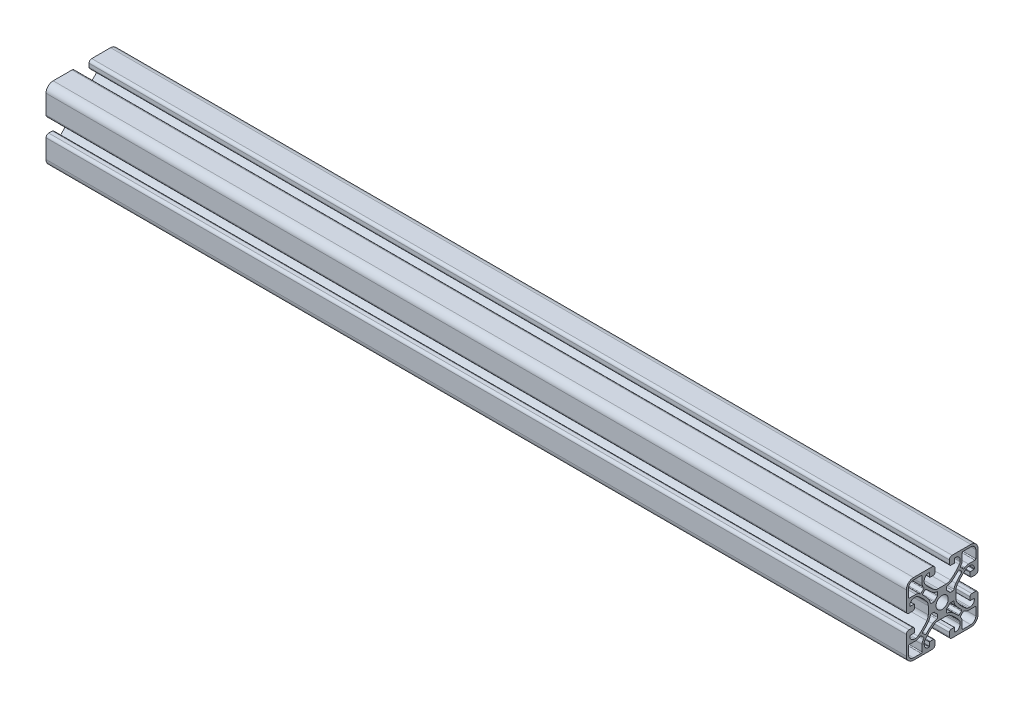
from build123d import *

# Parameters (mm, degrees)
SKETCH1_R           = 2.159
BOSS_EXTRUDE1_DEPTH = 304.8


with BuildPart() as part:
    # Sketch1 → Boss-Extrude1 (new body)
    with BuildSketch(Plane.YZ):
        with BuildLine():
            Line((0.772520695, -13.711151156), (0.772520695, -14.981151156))
            ThreePointArc((0.772520695, -14.981151156), (0.493539904, -15.654670365), (-0.179979305, -15.933651156))
            Line((-0.179979305, -15.933651156), (-6.847479304, -15.933651156))
            ThreePointArc((-6.847479304, -15.933651156), (-8.643530528, -15.18970238), (-9.387479304, -13.393651156))
            Line((-9.387479304, -13.393651156), (-9.387479304, -6.726151156))
            ThreePointArc((-9.387479304, -6.726151156), (-9.108498513, -6.052631947), (-8.434979304, -5.773651156))
            Line((-8.434979304, -5.773651156), (-7.164979304, -5.773651156))
            ThreePointArc((-7.164979304, -5.773651156), (-6.715966498, -5.95963835), (-6.529979304, -6.408651156))
            Line((-6.529979304, -6.408651156), (-6.529979304, -7.519901156))
            ThreePointArc((-6.529979304, -7.519901156), (-6.576476103, -7.632154358), (-6.688729304, -7.678651156))
            Line((-6.688729304, -7.678651156), (-7.958729304, -7.678651156))
            ThreePointArc((-7.958729304, -7.678651156), (-8.070982506, -7.725147955), (-8.117479304, -7.837401156))
            Line((-8.117479304, -7.837401156), (-8.117479304, -7.996151156))
            ThreePointArc((-8.117479304, -7.996151156), (-7.652511319, -9.118683171), (-6.529979304, -9.583651156))
            Line((-6.529979304, -9.583651156), (-6.034908058, -9.583651156))
            ThreePointArc((-6.034908058, -9.583651156), (-5.630688087, -9.517605564), (-5.268510552, -9.326338111))
            ThreePointArc((-5.268510552, -9.326338111), (-3.576591903, -7.846310071), (-2.110681684, -6.142144896))
            ThreePointArc((-2.110681684, -6.142144896), (-1.737480566, -5.424665046), (-1.608729304, -4.626241899))
            Line((-1.608729304, -4.626241899), (-1.608729304, -1.84106041))
            ThreePointArc((-1.608729304, -1.84106041), (-1.737480566, -1.042637264), (-2.110681683, -0.325157416))
            ThreePointArc((-2.110681683, -0.325157416), (-3.576591906, 1.379007761), (-5.268510559, 2.859035802))
            ThreePointArc((-5.268510559, 2.859035802), (-5.630688091, 3.050303253), (-6.034908058, 3.116348845))
            Line((-6.034908058, 3.116348845), (-6.529979305, 3.116348845))
            ThreePointArc((-6.529979305, 3.116348845), (-7.65251132, 2.65138086), (-8.117479305, 1.528848845))
            Line((-8.117479305, 1.528848845), (-8.117479305, 1.370098845))
            ThreePointArc((-8.117479305, 1.370098845), (-8.070982507, 1.257845643), (-7.958729305, 1.211348845))
            Line((-7.958729305, 1.211348845), (-6.688729305, 1.211348845))
            ThreePointArc((-6.688729305, 1.211348845), (-6.576476104, 1.164852046), (-6.529979305, 1.052598845))
            Line((-6.529979305, 1.052598845), (-6.529979305, -0.058651155))
            ThreePointArc((-6.529979305, -0.058651155), (-6.715966499, -0.507663961), (-7.164979305, -0.693651155))
            Line((-7.164979305, -0.693651155), (-8.434979305, -0.693651155))
            ThreePointArc((-8.434979305, -0.693651155), (-9.108498514, -0.414670364), (-9.387479305, 0.258848845))
            Line((-9.387479305, 0.258848845), (-9.387479305, 6.926348844))
            ThreePointArc((-9.387479305, 6.926348844), (-8.643530529, 8.722400069), (-6.847479305, 9.466348844))
            Line((-6.847479305, 9.466348844), (-0.179979306, 9.466348844))
            ThreePointArc((-0.179979306, 9.466348844), (0.493539903, 9.187368053), (0.772520694, 8.513848844))
            Line((0.772520694, 8.513848844), (0.772520694, 7.243848844))
            ThreePointArc((0.772520694, 7.243848844), (0.5865335, 6.794836038), (0.137520694, 6.608848844))
            Line((0.137520694, 6.608848844), (-0.973729306, 6.608848844))
            ThreePointArc((-0.973729306, 6.608848844), (-1.085982507, 6.655345643), (-1.132479306, 6.767598844))
            Line((-1.132479306, 6.767598844), (-1.132479306, 8.037598844))
            ThreePointArc((-1.132479306, 8.037598844), (-1.178976104, 8.149852046), (-1.291229306, 8.196348844))
            Line((-1.291229306, 8.196348844), (-1.449979306, 8.196348844))
            ThreePointArc((-1.449979306, 8.196348844), (-2.572511321, 7.73138086), (-3.037479306, 6.608848844))
            Line((-3.037479306, 6.608848844), (-3.037479306, 6.113777598))
            ThreePointArc((-3.037479306, 6.113777598), (-2.971433714, 5.709557627), (-2.780166261, 5.347380093))
            ThreePointArc((-2.780166261, 5.347380093), (-1.30013822, 3.655461444), (0.404026955, 2.189551224))
            ThreePointArc((0.404026955, 2.189551224), (1.121506805, 1.816350106), (1.919929952, 1.687598845))
            Line((1.919929952, 1.687598845), (4.705111441, 1.687598845))
            ThreePointArc((4.705111441, 1.687598845), (5.503534586, 1.816350106), (6.221014435, 2.189551223))
            ThreePointArc((6.221014435, 2.189551223), (7.925179612, 3.655461446), (9.405207653, 5.3473801))
            ThreePointArc((9.405207653, 5.3473801), (9.596475104, 5.709557631), (9.662520695, 6.113777598))
            Line((9.662520695, 6.113777598), (9.662520695, 6.608848846))
            ThreePointArc((9.662520695, 6.608848846), (9.197552711, 7.731380861), (8.075020695, 8.196348846))
            Line((8.075020695, 8.196348846), (7.916270695, 8.196348846))
            ThreePointArc((7.916270695, 8.196348846), (7.804017494, 8.149852047), (7.757520695, 8.037598846))
            Line((7.757520695, 8.037598846), (7.757520695, 6.767598846))
            ThreePointArc((7.757520695, 6.767598846), (7.711023897, 6.655345644), (7.598770695, 6.608848846))
            Line((7.598770695, 6.608848846), (6.487520696, 6.608848846))
            ThreePointArc((6.487520696, 6.608848846), (6.03850789, 6.79483604), (5.852520696, 7.243848846))
            Line((5.852520696, 7.243848846), (5.852520696, 8.513848846))
            ThreePointArc((5.852520696, 8.513848846), (6.131501487, 9.187368055), (6.805020696, 9.466348846))
            Line((6.805020696, 9.466348846), (13.472520695, 9.466348846))
            ThreePointArc((13.472520695, 9.466348846), (15.268571919, 8.72240007), (16.012520695, 6.926348846))
            Line((16.012520695, 6.926348846), (16.012520695, 0.258848846))
            ThreePointArc((16.012520695, 0.258848846), (15.733539904, -0.414670363), (15.060020695, -0.693651154))
            Line((15.060020695, -0.693651154), (13.790020695, -0.693651154))
            ThreePointArc((13.790020695, -0.693651154), (13.341007889, -0.50766396), (13.155020695, -0.058651154))
            Line((13.155020695, -0.058651154), (13.155020695, 1.052598846))
            ThreePointArc((13.155020695, 1.052598846), (13.201517494, 1.164852048), (13.313770695, 1.211348846))
            Line((13.313770695, 1.211348846), (14.583770695, 1.211348846))
            ThreePointArc((14.583770695, 1.211348846), (14.696023897, 1.257845645), (14.742520695, 1.370098846))
            Line((14.742520695, 1.370098846), (14.742520695, 1.528848846))
            ThreePointArc((14.742520695, 1.528848846), (14.27755271, 2.651380861), (13.155020695, 3.116348846))
            Line((13.155020695, 3.116348846), (12.659949449, 3.116348846))
            ThreePointArc((12.659949449, 3.116348846), (12.255729478, 3.050303254), (11.893551943, 2.859035801))
            ThreePointArc((11.893551943, 2.859035801), (10.201633294, 1.37900776), (8.735723075, -0.325157415))
            ThreePointArc((8.735723075, -0.325157415), (8.362521957, -1.042637264), (8.233770695, -1.841060411))
            Line((8.233770695, -1.841060411), (8.233770695, -4.626241901))
            ThreePointArc((8.233770695, -4.626241901), (8.362521957, -5.424665046), (8.735723074, -6.142144894))
            ThreePointArc((8.735723074, -6.142144894), (10.201633297, -7.846310072), (11.89355195, -9.326338113))
            ThreePointArc((11.89355195, -9.326338113), (12.255729482, -9.517605564), (12.659949449, -9.583651155))
            Line((12.659949449, -9.583651155), (13.155020696, -9.583651155))
            ThreePointArc((13.155020696, -9.583651155), (14.277552711, -9.11868317), (14.742520696, -7.996151155))
            Line((14.742520696, -7.996151155), (14.742520696, -7.837401155))
            ThreePointArc((14.742520696, -7.837401155), (14.696023898, -7.725147954), (14.583770696, -7.678651155))
            Line((14.583770696, -7.678651155), (13.313770696, -7.678651155))
            ThreePointArc((13.313770696, -7.678651155), (13.201517495, -7.632154357), (13.155020696, -7.519901155))
            Line((13.155020696, -7.519901155), (13.155020696, -6.408651155))
            ThreePointArc((13.155020696, -6.408651155), (13.34100789, -5.959638349), (13.790020696, -5.773651155))
            Line((13.790020696, -5.773651155), (15.060020696, -5.773651155))
            ThreePointArc((15.060020696, -5.773651155), (15.733539905, -6.052631946), (16.012520696, -6.726151155))
            Line((16.012520696, -6.726151155), (16.012520696, -13.393651155))
            ThreePointArc((16.012520696, -13.393651155), (15.26857192, -15.189702379), (13.472520696, -15.933651155))
            Line((13.472520696, -15.933651155), (6.805020697, -15.933651155))
            ThreePointArc((6.805020697, -15.933651155), (6.131501488, -15.654670364), (5.852520697, -14.981151155))
            Line((5.852520697, -14.981151155), (5.852520697, -13.711151155))
            ThreePointArc((5.852520697, -13.711151155), (6.038507891, -13.262138349), (6.487520697, -13.076151155))
            Line((6.487520697, -13.076151155), (7.598770697, -13.076151155))
            ThreePointArc((7.598770697, -13.076151155), (7.711023898, -13.122647953), (7.757520697, -13.234901155))
            Line((7.757520697, -13.234901155), (7.757520697, -14.504901155))
            ThreePointArc((7.757520697, -14.504901155), (7.804017495, -14.617154356), (7.916270697, -14.663651155))
            Line((7.916270697, -14.663651155), (8.075020697, -14.663651155))
            ThreePointArc((8.075020697, -14.663651155), (9.197552712, -14.19868317), (9.662520697, -13.076151155))
            Line((9.662520697, -13.076151155), (9.662520697, -12.581079908))
            ThreePointArc((9.662520697, -12.581079908), (9.596475104, -12.176859938), (9.405207651, -11.814682403))
            ThreePointArc((9.405207651, -11.814682403), (7.925179611, -10.122763754), (6.221014436, -8.656853534))
            ThreePointArc((6.221014436, -8.656853534), (5.503534586, -8.283652417), (4.705111439, -8.154901155))
            Line((4.705111439, -8.154901155), (1.91992995, -8.154901155))
            ThreePointArc((1.91992995, -8.154901155), (1.121506805, -8.283652417), (0.404026956, -8.656853534))
            ThreePointArc((0.404026956, -8.656853534), (-1.300138221, -10.122763756), (-2.780166262, -11.81468241))
            ThreePointArc((-2.780166262, -11.81468241), (-2.971433713, -12.176859941), (-3.037479304, -12.581079908))
            Line((-3.037479304, -12.581079908), (-3.037479304, -13.076151156))
            ThreePointArc((-3.037479304, -13.076151156), (-2.57251132, -14.198683171), (-1.449979305, -14.663651156))
            Line((-1.449979305, -14.663651156), (-1.291229305, -14.663651156))
            ThreePointArc((-1.291229305, -14.663651156), (-1.178976103, -14.617154357), (-1.132479305, -14.504901156))
            Line((-1.132479305, -14.504901156), (-1.132479305, -13.234901156))
            ThreePointArc((-1.132479305, -13.234901156), (-1.085982506, -13.122647954), (-0.973729305, -13.076151156))
            Line((-0.973729305, -13.076151156), (0.137520695, -13.076151156))
            ThreePointArc((0.137520695, -13.076151156), (0.586533501, -13.26213835), (0.772520695, -13.711151156))
        make_face()
        with Locations(Location((3.312520697, -3.233651155, 0), (0, 0, 90))):
            Circle(SKETCH1_R, mode=Mode.SUBTRACT)
        with BuildLine():
            Line((9.84481504, 4.637844283), (10.012608151, 4.8557916))
            ThreePointArc((10.012608151, 4.8557916), (10.318636081, 5.435275655), (10.42430903, 6.082027611))
            Line((10.42430903, 6.082027611), (10.42430903, 8.386848856))
            ThreePointArc((10.42430903, 8.386848856), (10.517302627, 8.611355259), (10.74180903, 8.704348856))
            Line((10.74180903, 8.704348856), (13.472309014, 8.704348856))
            ThreePointArc((13.472309014, 8.704348856), (14.729544877, 8.183584711), (15.250309023, 6.926348847))
            Line((15.250309023, 6.926348847), (15.250309023, 4.19584885))
            ThreePointArc((15.250309023, 4.19584885), (15.157315426, 3.971342447), (14.932809023, 3.87834885))
            Line((14.932809023, 3.87834885), (12.627987776, 3.87834885))
            ThreePointArc((12.627987776, 3.87834885), (11.981235825, 3.772675903), (11.401751773, 3.466647978))
            Line((11.401751773, 3.466647978), (11.183804456, 3.298854867))
            ThreePointArc((11.183804456, 3.298854867), (10.968844184, 3.23190561), (10.763539377, 3.324318043))
            Line((10.763539377, 3.324318043), (9.870278216, 4.217579204))
            ThreePointArc((9.870278216, 4.217579204), (9.777865783, 4.422884011), (9.84481504, 4.637844283))
        make_face(mode=Mode.SUBTRACT)
        with BuildLine():
            Line((-4.558974742, 3.298643188), (-4.776922058, 3.466436299))
            ThreePointArc((-4.776922058, 3.466436299), (-5.35640611, 3.772464224), (-6.003158061, 3.878137171))
            Line((-6.003158061, 3.878137171), (-8.307979315, 3.878137171))
            ThreePointArc((-8.307979315, 3.878137171), (-8.532485718, 3.971130768), (-8.625479315, 4.195637171))
            Line((-8.625479315, 4.195637171), (-8.625479315, 6.926137161))
            ThreePointArc((-8.625479315, 6.926137161), (-8.104715169, 8.183373025), (-6.847479306, 8.704137171))
            Line((-6.847479306, 8.704137171), (-4.116979309, 8.704137171))
            ThreePointArc((-4.116979309, 8.704137171), (-3.892472906, 8.611143574), (-3.799479309, 8.386637171))
            Line((-3.799479309, 8.386637171), (-3.799479309, 6.081815924))
            ThreePointArc((-3.799479309, 6.081815924), (-3.693806362, 5.435063973), (-3.387778437, 4.85557992))
            Line((-3.387778437, 4.85557992), (-3.219985326, 4.637632604))
            ThreePointArc((-3.219985326, 4.637632604), (-3.153036069, 4.422672332), (-3.245448502, 4.217367525))
            Line((-3.245448502, 4.217367525), (-4.138709663, 3.324106364))
            ThreePointArc((-4.138709663, 3.324106364), (-4.34401447, 3.231693931), (-4.558974742, 3.298643188))
        make_face(mode=Mode.SUBTRACT)
        with BuildLine():
            Line((4.900020697, -0.306445792), (4.900020697, 0.638730742))
            ThreePointArc((4.900020697, 0.638730742), (4.978885643, 0.848157487), (5.176301398, 0.953543734))
            ThreePointArc((5.176301398, 0.953543734), (5.993365908, 1.169605569), (6.728820708, 1.585998853))
            ThreePointArc((6.728820708, 1.585998853), (7.886169011, 2.538405301), (8.953104421, 3.591107524))
            ThreePointArc((8.953104421, 3.591107524), (9.179965542, 3.692814602), (9.41055899, 3.599879359))
            Line((9.41055899, 3.599879359), (10.146051215, 2.864387135))
            ThreePointArc((10.146051215, 2.864387135), (10.238986457, 2.633793689), (10.137279379, 2.406932571))
            ThreePointArc((10.137279379, 2.406932571), (9.084577143, 1.339997151), (8.132170687, 0.182648832))
            ThreePointArc((8.132170687, 0.182648832), (7.715777415, -0.552805957), (7.499715586, -1.369870454))
            ThreePointArc((7.499715586, -1.369870454), (7.39432934, -1.567286209), (7.184902595, -1.646151156))
            Line((7.184902595, -1.646151156), (6.23972607, -1.646151156))
            ThreePointArc((6.23972607, -1.646151156), (6.08836388, -1.607749235), (5.973616485, -1.501832971))
            ThreePointArc((5.973616485, -1.501832971), (5.557584726, -0.98858712), (5.044338875, -0.572555363))
            ThreePointArc((5.044338875, -0.572555363), (4.938422615, -0.457807974), (4.900020697, -0.306445792))
        make_face(mode=Mode.SUBTRACT)
        with BuildLine():
            Line((0.385315334, -1.646151156), (-0.559861201, -1.646151156))
            ThreePointArc((-0.559861201, -1.646151156), (-0.769287945, -1.567286209), (-0.874674192, -1.369870455))
            ThreePointArc((-0.874674192, -1.369870455), (-1.090736028, -0.552805945), (-1.507129311, 0.182648856))
            ThreePointArc((-1.507129311, 0.182648856), (-2.459535759, 1.339997159), (-3.512237982, 2.406932568))
            ThreePointArc((-3.512237982, 2.406932568), (-3.61394506, 2.633793689), (-3.521009818, 2.864387138))
            Line((-3.521009818, 2.864387138), (-2.785517593, 3.599879363))
            ThreePointArc((-2.785517593, 3.599879363), (-2.554924147, 3.692814604), (-2.328063029, 3.591107527))
            ThreePointArc((-2.328063029, 3.591107527), (-1.26112761, 2.538405291), (-0.103779291, 1.585998835))
            ThreePointArc((-0.103779291, 1.585998835), (0.631675499, 1.169605562), (1.448739995, 0.953543734))
            ThreePointArc((1.448739995, 0.953543734), (1.64615575, 0.848157487), (1.725020697, 0.638730743))
            Line((1.725020697, 0.638730743), (1.725020697, -0.306445783))
            ThreePointArc((1.725020697, -0.306445783), (1.686618777, -0.457807972), (1.580702512, -0.572555367))
            ThreePointArc((1.580702512, -0.572555367), (1.067456662, -0.988587126), (0.651424905, -1.501832978))
            ThreePointArc((0.651424905, -1.501832978), (0.536677515, -1.607749237), (0.385315334, -1.646151156))
        make_face(mode=Mode.SUBTRACT)
        with BuildLine():
            Line((-3.219773646, -11.105146594), (-3.387566758, -11.32309391))
            ThreePointArc((-3.387566758, -11.32309391), (-3.693594682, -11.902577963), (-3.79926763, -12.549329913))
            Line((-3.79926763, -12.549329913), (-3.79926763, -14.854151161))
            ThreePointArc((-3.79926763, -14.854151161), (-3.892261226, -15.078657564), (-4.116767629, -15.171651161))
            Line((-4.116767629, -15.171651161), (-6.847267613, -15.171651161))
            ThreePointArc((-6.847267613, -15.171651161), (-8.104503477, -14.650887015), (-8.625267623, -13.393651152))
            Line((-8.625267623, -13.393651152), (-8.625267623, -10.663151161))
            ThreePointArc((-8.625267623, -10.663151161), (-8.532274026, -10.438644758), (-8.307767623, -10.345651161))
            Line((-8.307767623, -10.345651161), (-6.002946382, -10.345651161))
            ThreePointArc((-6.002946382, -10.345651161), (-5.356194431, -10.239978214), (-4.776710379, -9.933950289))
            Line((-4.776710379, -9.933950289), (-4.558763062, -9.766157178))
            ThreePointArc((-4.558763062, -9.766157178), (-4.34380279, -9.699207921), (-4.138497984, -9.791620354))
            Line((-4.138497984, -9.791620354), (-3.245236822, -10.684881515))
            ThreePointArc((-3.245236822, -10.684881515), (-3.152824389, -10.890186322), (-3.219773646, -11.105146594))
        make_face(mode=Mode.SUBTRACT)
        with BuildLine():
            Line((11.184016136, -9.765945499), (11.401963452, -9.93373861))
            ThreePointArc((11.401963452, -9.93373861), (11.981447504, -10.239766535), (12.628199455, -10.345439482))
            Line((12.628199455, -10.345439482), (14.933020703, -10.345439482))
            ThreePointArc((14.933020703, -10.345439482), (15.157527106, -10.438433079), (15.250520703, -10.662939482))
            Line((15.250520703, -10.662939482), (15.250520703, -13.393439466))
            ThreePointArc((15.250520703, -13.393439466), (14.729756557, -14.650675329), (13.472520693, -15.171439475))
            Line((13.472520693, -15.171439475), (10.742020697, -15.171439475))
            ThreePointArc((10.742020697, -15.171439475), (10.517514293, -15.078445878), (10.424520697, -14.853939475))
            Line((10.424520697, -14.853939475), (10.424520697, -12.549118226))
            ThreePointArc((10.424520697, -12.549118226), (10.318847751, -11.90236628), (10.012819831, -11.322882231))
            Line((10.012819831, -11.322882231), (9.84502672, -11.104934915))
            ThreePointArc((9.84502672, -11.104934915), (9.778077463, -10.889974643), (9.870489896, -10.684669836))
            Line((9.870489896, -10.684669836), (10.763751057, -9.791408675))
            ThreePointArc((10.763751057, -9.791408675), (10.969055864, -9.698996242), (11.184016136, -9.765945499))
        make_face(mode=Mode.SUBTRACT)
        with BuildLine():
            Line((1.725020697, -6.160856519), (1.725020697, -7.106033053))
            ThreePointArc((1.725020697, -7.106033053), (1.646155751, -7.315459798), (1.448739996, -7.420846044))
            ThreePointArc((1.448739996, -7.420846044), (0.631675486, -7.63690788), (-0.103779314, -8.053301163))
            ThreePointArc((-0.103779314, -8.053301163), (-1.261127617, -9.005707612), (-2.328063027, -10.058409834))
            ThreePointArc((-2.328063027, -10.058409834), (-2.554924148, -10.160116913), (-2.785517596, -10.06718167))
            Line((-2.785517596, -10.06718167), (-3.521009821, -9.331689445))
            ThreePointArc((-3.521009821, -9.331689445), (-3.613945063, -9.101096), (-3.512237985, -8.874234882))
            ThreePointArc((-3.512237985, -8.874234882), (-2.459535749, -7.807299462), (-1.507129293, -6.649951143))
            ThreePointArc((-1.507129293, -6.649951143), (-1.090736021, -5.914496353), (-0.874674192, -5.097431857))
            ThreePointArc((-0.874674192, -5.097431857), (-0.769287946, -4.900016102), (-0.559861201, -4.821151155))
            Line((-0.559861201, -4.821151155), (0.385315324, -4.821151155))
            ThreePointArc((0.385315324, -4.821151155), (0.536677514, -4.859553075), (0.651424909, -4.96546934))
            ThreePointArc((0.651424909, -4.96546934), (1.067456668, -5.478715191), (1.580702519, -5.894746948))
            ThreePointArc((1.580702519, -5.894746948), (1.686618779, -6.009494337), (1.725020697, -6.160856519))
        make_face(mode=Mode.SUBTRACT)
        with BuildLine():
            Line((6.23972606, -4.821151155), (7.184902595, -4.821151155))
            ThreePointArc((7.184902595, -4.821151155), (7.394329339, -4.900016102), (7.499715586, -5.097431856))
            ThreePointArc((7.499715586, -5.097431856), (7.715777422, -5.914496366), (8.132170705, -6.649951166))
            ThreePointArc((8.132170705, -6.649951166), (9.084577153, -7.80729947), (10.137279376, -8.874234879))
            ThreePointArc((10.137279376, -8.874234879), (10.238986455, -9.101096), (10.146051212, -9.331689449))
            Line((10.146051212, -9.331689449), (9.410558987, -10.067181674))
            ThreePointArc((9.410558987, -10.067181674), (9.179965541, -10.160116915), (8.953104423, -10.058409837))
            ThreePointArc((8.953104423, -10.058409837), (7.886169003, -9.005707601), (6.728820685, -8.053301146))
            ThreePointArc((6.728820685, -8.053301146), (5.993365895, -7.636907873), (5.176301399, -7.420846045))
            ThreePointArc((5.176301399, -7.420846045), (4.978885644, -7.315459798), (4.900020697, -7.106033054))
            Line((4.900020697, -7.106033054), (4.900020697, -6.160856528))
            ThreePointArc((4.900020697, -6.160856528), (4.938422617, -6.009494339), (5.044338882, -5.894746943))
            ThreePointArc((5.044338882, -5.894746943), (5.557584732, -5.478715185), (5.973616489, -4.965469333))
            ThreePointArc((5.973616489, -4.965469333), (6.088363879, -4.859553074), (6.23972606, -4.821151155))
        make_face(mode=Mode.SUBTRACT)
    extrude(amount=BOSS_EXTRUDE1_DEPTH)


solid = part.part
